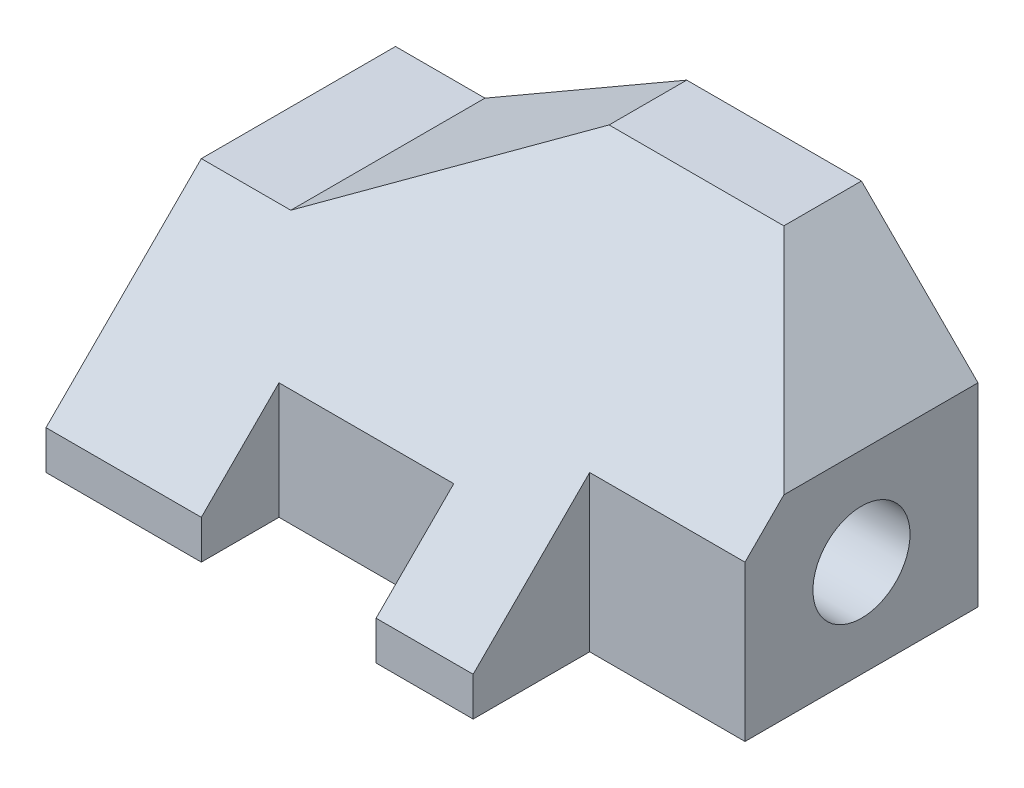
from build123d import *

# Parameters (mm, degrees)
ESQUISSE1_W                           = 95.25
ESQUISSE1_H                           = 57.15
BASE_EXTRUSION_DEPTH                  = 50.8
ENL_V_MAT_EXTRU_1_DEPTH               = 123.144688792
ESQUISSE3_W                           = 25.4
ESQUISSE3_H                           = 19.05
ESQUISSE3_W_2                         = 28.575
ESQUISSE3_H_2                         = 12.7
ENL_V_MAT_EXTRU_2_DEPTH               = 123.144688792
CHANFREIN1_SIZE                       = 19.05
ENL_V_MAT_EXTRU_3_DEPTH               = 123.144688792
DIAM_TRE_DU_PER_AGE_5_8_0_625_2_D     = 15.875
DIAM_TRE_DU_PER_AGE_5_8_0_625_2_DEPTH = 31.75
DIAM_TRE_DU_PER_AGE_5_8_0_625_2_TIP   = 4.769331164


with BuildPart() as part:
    # Esquisse1 → Base-Extrusion (new body)
    with BuildSketch(Plane(origin=(0, 0, 0), x_dir=(1, 0, 0), z_dir=(0, 1, 0))):
        with Locations((47.625, 28.575)):
            Rectangle(ESQUISSE1_W, ESQUISSE1_H)
    extrude(amount=BASE_EXTRUSION_DEPTH)

    # Esquisse2 → Enlèv. mat.-Extru.1 (cut, through all)
    with BuildSketch(Plane(origin=(95.25, 0, 0), x_dir=(0, 0, -1), z_dir=(1, 0, 0))):
        Polygon((44.45, 50.8), (0, 6.35), (0, 50.8), align=None)
    extrude(amount=-ENL_V_MAT_EXTRU_1_DEPTH, mode=Mode.SUBTRACT)

    # Esquisse3 → Enlèv. mat.-Extru.2 (cut, through all)
    with BuildSketch(Plane.XZ):
        with Locations((82.55, -9.525)):
            Rectangle(ESQUISSE3_W, ESQUISSE3_H)
        with Locations((39.6875, -6.35)):
            Rectangle(ESQUISSE3_W_2, ESQUISSE3_H_2)
    extrude(amount=-ENL_V_MAT_EXTRU_2_DEPTH, mode=Mode.SUBTRACT)

    # Chanfrein1
    chanfrein1_edges = [part.edges().sort_by_distance(p)[0] for p in [
        (95.25, 50.8, -50.8),
    ]]
    chamfer(chanfrein1_edges, length=CHANFREIN1_SIZE)

    # Esquisse4 → Enlèv. mat.-Extru.3 (cut, through all)
    with BuildSketch(Plane(origin=(0, 0, -57.15), x_dir=(-1, 0, 0), z_dir=(0, 0, -1))):
        Polygon((0, 50.8), (-47.625, 50.8), (-14.629432116, 31.75), (0, 31.75), align=None)
    extrude(amount=-ENL_V_MAT_EXTRU_3_DEPTH, mode=Mode.SUBTRACT)

    # Diamètre du perçage 5/8 (0.625)2
    with Locations(Plane(origin=(95.25, 0, 0), x_dir=(0, 0, -1), z_dir=(1, 0, 0))):
        with Locations((38.1, 15.875)):
            Hole(DIAM_TRE_DU_PER_AGE_5_8_0_625_2_D / 2, depth=DIAM_TRE_DU_PER_AGE_5_8_0_625_2_DEPTH)
            with Locations((0, 0, -(DIAM_TRE_DU_PER_AGE_5_8_0_625_2_DEPTH + DIAM_TRE_DU_PER_AGE_5_8_0_625_2_TIP / 2))):  # 118° drill point
                Cone(0, DIAM_TRE_DU_PER_AGE_5_8_0_625_2_D / 2, DIAM_TRE_DU_PER_AGE_5_8_0_625_2_TIP, mode=Mode.SUBTRACT)


solid = part.part
